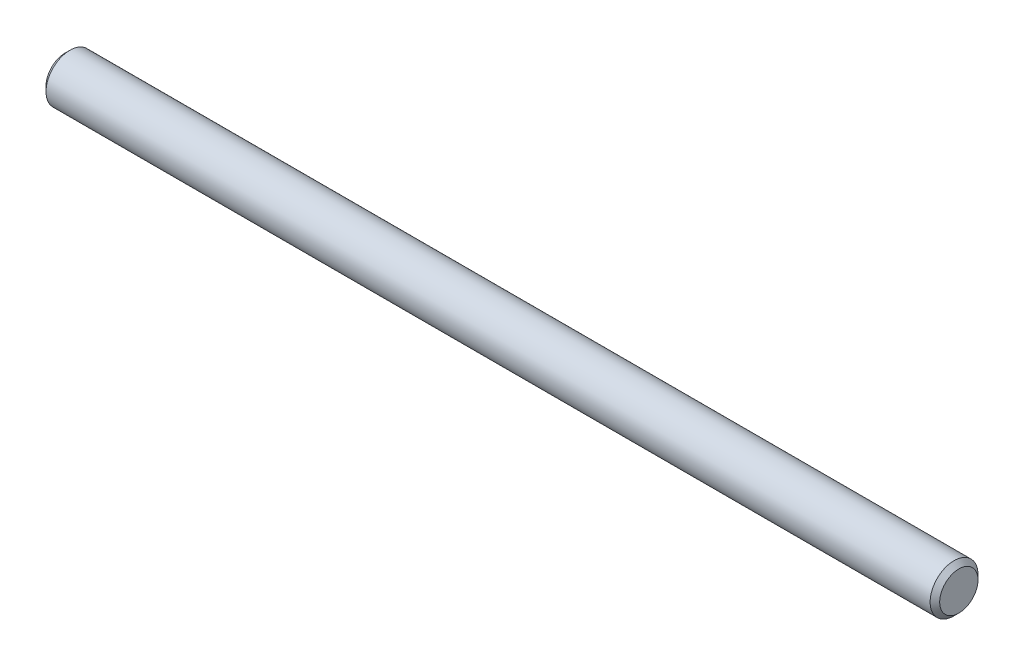
from build123d import *

# Parameters (mm, degrees)
EXTRUDE1_DEPTH      = 88.9
EXTRUDE1_DEPTH_BACK = 88.9
SKETCH2_R           = 4.7625
CHAMFER1_SIZE       = 0.9525


with BuildPart() as part:
    # Sketch2 → Extrude1 (new, two sides: drawn at the far end of the back side and taken through both)
    with BuildSketch(Plane(origin=(0, 0, 0), x_dir=(0, 0, -1), z_dir=(1, 0, 0)).offset(-EXTRUDE1_DEPTH_BACK)):
        Circle(SKETCH2_R)
    extrude(amount=EXTRUDE1_DEPTH + EXTRUDE1_DEPTH_BACK)

    # Chamfer1
    chamfer1_edges = [part.edges().sort_by_distance(p)[0] for p in [
        (-88.9, 0, 4.7625),
        (88.9, 0, 4.7625),
    ]]
    chamfer(chamfer1_edges, length=CHAMFER1_SIZE)


solid = part.part
